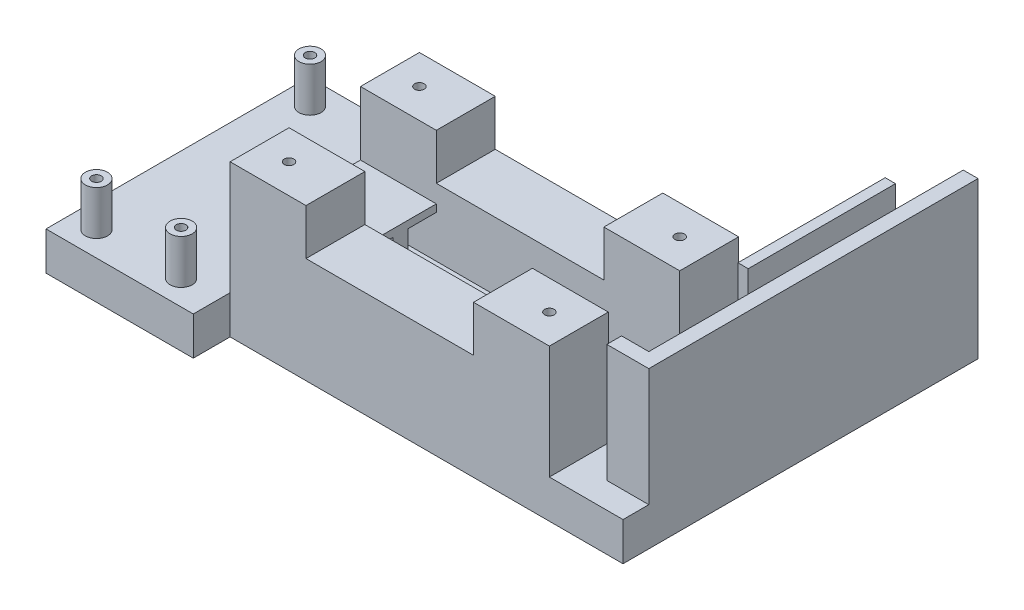
from build123d import *

# Parameters (mm, degrees)
EXTRUDE_1_DEPTH     = 16
F_1_0MM_1_D         = 2.6
F_1_0MM_2_D         = 2.6
SKETCH_8_W          = 86.7
SKETCH_8_H          = 16
EXTRUDE_2_DEPTH     = 21.2
SKETCH_9_W          = 86.7
SKETCH_9_H          = 10.4
EXTRUDE_3_DEPTH     = 9.7
SKETCH_15_W         = 20.6
SKETCH_15_H         = 2
EXTRUDE_8_DEPTH     = 13.5
SKETCH_16_W         = 20.6
SKETCH_16_H         = 2
EXTRUDE_9_DEPTH     = 10.5
SKETCH_19_W         = 51.4
SKETCH_19_H         = 10.4
EXTRUDE_10_DEPTH    = 20
SKETCH_25_W         = 20
SKETCH_25_H         = 10.4
EXTRUDE_11_DEPTH    = 45
EXTRUDE_12_DEPTH    = 32
CUT_EXTRUDE_1_DEPTH = 5
SKETCH_29_W         = 51.4
SKETCH_29_H         = 10.402970243
EXTRUDE_13_DEPTH    = 40
SKETCH_32_W         = 40
SKETCH_32_H         = 10.402970243
EXTRUDE_14_DEPTH    = 10
SKETCH_33_W         = 40
SKETCH_33_H         = 10.402970243
EXTRUDE_15_DEPTH    = 10
SKETCH_34_R         = 3
EXTRUDE_16_DEPTH    = 12
F_1_0MM_3_D         = 2.6
F_1_0MM_4_D         = 2.6


with BuildPart() as part:
    # 草图1 → 凸台-拉伸1 (new body)
    with BuildSketch(Plane.XY):
        Polygon((-21.523113208, 25.59839861), (-42.123113208, 25.59839861), (-42.123113208, 5.59839861), (44.576886792, 5.59839861), (44.576886792, 25.59839861), (23.976886792, 25.59839861), (23.976886792, 13.12839861), (-21.523113208, 13.12839861), align=None)
    extrude_1 = extrude(amount=EXTRUDE_1_DEPTH)

    # Ø1.0mm 暗销孔1 (through all)
    with Locations(Plane(origin=(0, 25.59839861, 0), x_dir=(1, 0, 0), z_dir=(0, 1, 0))):
        with Locations((36.576886792, -8)):
            f_1_0mm_1 = Hole(F_1_0MM_1_D / 2)

    # Ø1.0mm 暗销孔2 (through all)
    with Locations(Plane(origin=(0, 25.59839861, 0), x_dir=(1, 0, 0), z_dir=(0, 1, 0))):
        with Locations((-34.123113208, -8)):
            f_1_0mm_2 = Hole(F_1_0MM_2_D / 2)

    # 草图8 → 凸台-拉伸2 (add)
    with BuildSketch(Plane.XZ.offset(-5.59839861)):
        with Locations((1.226886792, 8)):
            Rectangle(SKETCH_8_W, SKETCH_8_H)
    extrude_2 = extrude(amount=EXTRUDE_2_DEPTH)

    # 草图9 → 凸台-拉伸3 (add)
    with BuildSketch(Plane(origin=(0, 0, 0), x_dir=(-1, 0, 0), z_dir=(0, 0, -1))):
        with Locations((-1.226886792, -10.40160139)):
            Rectangle(SKETCH_9_W, SKETCH_9_H)
    extrude_3 = extrude(amount=EXTRUDE_3_DEPTH)

    # 草图15 → 凸台-拉伸8 (add)
    with BuildSketch(Plane(origin=(0, -5.20160139, 0), x_dir=(1, 0, 0), z_dir=(0, 1, 0))):
        with Locations((-31.823113208, 8.7)):
            Rectangle(SKETCH_15_W, SKETCH_15_H)
    extrude_8 = extrude(amount=EXTRUDE_8_DEPTH)

    # 草图16 → 凸台-拉伸9 (add)
    with BuildSketch(Plane(origin=(0, 0, -9.7), x_dir=(-1, 0, 0), z_dir=(0, 0, -1))):
        with Locations((31.823113208, 7.29839861)):
            Rectangle(SKETCH_16_W, SKETCH_16_H)
    extrude_9 = extrude(amount=-EXTRUDE_9_DEPTH)

    # 镜向20: 凸台-拉伸1, Ø1.0mm 暗销孔1, Ø1.0mm 暗销孔2, 凸台-拉伸2, 凸台-拉伸3, 凸台-拉伸8, 凸台-拉伸9 across plane
    add(extrude_1.mirror(Plane.XY.offset(-9.7)))
    add(f_1_0mm_1.mirror(Plane.XY.offset(-9.7)), mode=Mode.SUBTRACT)
    add(f_1_0mm_2.mirror(Plane.XY.offset(-9.7)), mode=Mode.SUBTRACT)
    add(extrude_2.mirror(Plane.XY.offset(-9.7)))
    add(extrude_3.mirror(Plane.XY.offset(-9.7)))
    add(extrude_8.mirror(Plane.XY.offset(-9.7)))
    add(extrude_9.mirror(Plane.XY.offset(-9.7)))

    # 草图19 → 凸台-拉伸10 (add)
    with BuildSketch(Plane(origin=(44.576886792, 0, 0), x_dir=(0, 0, -1), z_dir=(1, 0, 0))):
        with Locations((9.7, -10.40160139)):
            Rectangle(SKETCH_19_W, SKETCH_19_H)
    extrude(amount=EXTRUDE_10_DEPTH)

    # 草图25 → 凸台-拉伸11 (add)
    with BuildSketch(Plane(origin=(0, 0, -35.4), x_dir=(-1, 0, 0), z_dir=(0, 0, -1))):
        with Locations((-54.576886792, -10.40160139)):
            Rectangle(SKETCH_25_W, SKETCH_25_H)
    extrude(amount=EXTRUDE_11_DEPTH)

    # 草图26 → 凸台-拉伸12 (add)
    with BuildSketch(Plane(origin=(0, -5.20160139, 0), x_dir=(1, 0, 0), z_dir=(0, 1, 0))):
        Polygon((53.176886792, -9), (64.576886792, -9), (64.576886792, -5), (64.576886792, 80.4), (60.576886792, 80.4), (60.576886792, -5), (53.176886792, -5), align=None)
        Polygon((53.176886792, 28), (54.576886792, 28), (54.576886792, 68), (53.176886792, 68), (51.776886792, 68), (51.776886792, 28), align=None)
    extrude(amount=EXTRUDE_12_DEPTH)

    # 草图28 → 切除-拉伸1 (cut)
    with BuildSketch(Plane(origin=(0, -5.20160139, 0), x_dir=(1, 0, 0), z_dir=(0, 1, 0))):
        Polygon((60.576886792, 80.4), (54.576886792, 80.4), (54.576886792, 28), (52.576886792, 28), (52.576886792, -5), (54.576886792, -5), (60.576886792, -5), (60.576886792, 28), align=None)
    extrude(amount=-CUT_EXTRUDE_1_DEPTH, mode=Mode.SUBTRACT)

    # 草图29 → 凸台-拉伸13 (add)
    with BuildSketch(Plane.ZY.offset(42.123113208)):
        with Locations((-9.7, -10.400116268)):
            Rectangle(SKETCH_29_W, SKETCH_29_H)
    extrude(amount=EXTRUDE_13_DEPTH)

    # 草图32 → 凸台-拉伸14 (add)
    with BuildSketch(Plane(origin=(0, 0, -35.4), x_dir=(-1, 0, 0), z_dir=(0, 0, -1))):
        with Locations((62.123113208, -10.400116268)):
            Rectangle(SKETCH_32_W, SKETCH_32_H)
    extrude(amount=EXTRUDE_14_DEPTH)

    # 草图33 → 凸台-拉伸15 (add)
    with BuildSketch(Plane.XY.offset(16)):
        with Locations((-62.123113208, -10.400116268)):
            Rectangle(SKETCH_33_W, SKETCH_33_H)
    extrude(amount=EXTRUDE_15_DEPTH)

    # 草图34 → 凸台-拉伸16 (add)
    with BuildSketch(Plane(origin=(0, -5.198631147, 0), x_dir=(1, 0, 0), z_dir=(0, 1, 0))):
        with Locations(Location((-52.123113208, 38.7, 0), (0, 0, 90))):
            Circle(SKETCH_34_R)
        with Locations(Location((-75.123113208, 38.7, 0), (0, 0, 90))):
            Circle(SKETCH_34_R)
        with Locations(Location((-52.123113208, -19.3, 0), (0, 0, 90))):
            Circle(SKETCH_34_R)
        with Locations(Location((-75.123113208, -19.3, 0), (0, 0, 90))):
            Circle(SKETCH_34_R)
    extrude(amount=EXTRUDE_16_DEPTH)

    # Ø1.0mm 暗销孔3 (through all)
    with Locations(Plane(origin=(0, 6.801368853, 0), x_dir=(1, 0, 0), z_dir=(0, 1, 0))):
        with Locations((-52.123113208, 38.7)):
            Hole(F_1_0MM_3_D / 2)

    # Ø1.0mm 暗销孔4 (through all)
    with Locations(Plane(origin=(0, 6.801368853, 0), x_dir=(1, 0, 0), z_dir=(0, 1, 0))):
        with Locations((-52.123113208, -19.3), (-75.123113208, 38.7), (-75.123113208, -19.3)):
            Hole(F_1_0MM_4_D / 2)


solid = part.part
